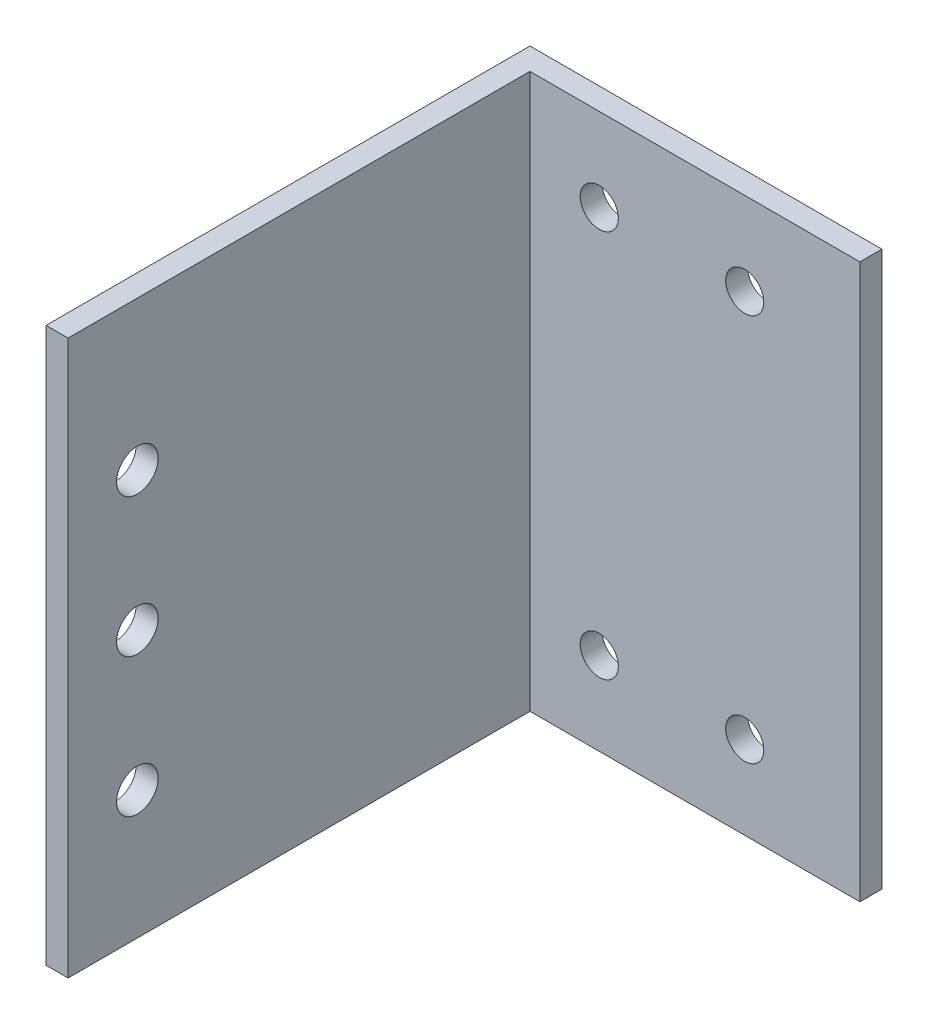
from build123d import *

# Parameters (mm, degrees)
CROQUIS2_W              = 50.8
CROQUIS2_H              = 80
SALIENTE_EXTRUIR1_DEPTH = 3.175
CROQUIS3_W              = 3.175
CROQUIS3_H              = 80
SALIENTE_EXTRUIR2_DEPTH = 66.675
CROQUIS4_R              = 2.75
CORTAR_EXTRUIR1_DEPTH   = 47.625
CROQUIS5_R              = 3
CORTAR_EXTRUIR2_DEPTH   = 47.625


with BuildPart() as part:
    # Croquis2 → Saliente-Extruir1 (new body)
    with BuildSketch(Plane.XY):
        with Locations((25.4, 40)):
            Rectangle(CROQUIS2_W, CROQUIS2_H)
    extrude(amount=SALIENTE_EXTRUIR1_DEPTH)

    # Croquis3 → Saliente-Extruir2 (add)
    with BuildSketch(Plane.XY.offset(3.175)):
        with Locations((1.5875, 40)):
            Rectangle(CROQUIS3_W, CROQUIS3_H)
    extrude(amount=SALIENTE_EXTRUIR2_DEPTH)

    # Croquis4 → Cortar-Extruir1 (cut)
    with BuildSketch(Plane.XY.offset(3.175)):
        with Locations((13.175, 68)):
            Circle(CROQUIS4_R)
        with Locations((13.175, 12)):
            Circle(CROQUIS4_R)
        with Locations((34.175, 68)):
            Circle(CROQUIS4_R)
        with Locations((34.175, 12)):
            Circle(CROQUIS4_R)
    extrude(amount=-CORTAR_EXTRUIR1_DEPTH, mode=Mode.SUBTRACT)

    # Croquis5 → Cortar-Extruir2 (cut)
    with BuildSketch(Plane(origin=(3.175, 0, 0), x_dir=(0, 0, -1), z_dir=(1, 0, 0))):
        with Locations(Location((-59.85, 18.5, 0), (0, 0, 90))):
            Circle(CROQUIS5_R)
        with Locations(Location((-59.85, 38.5, 0), (0, 0, 90))):
            Circle(CROQUIS5_R)
        with Locations(Location((-59.85, 58.5, 0), (0, 0, 90))):
            Circle(CROQUIS5_R)
    extrude(amount=-CORTAR_EXTRUIR2_DEPTH, mode=Mode.SUBTRACT)


solid = part.part
